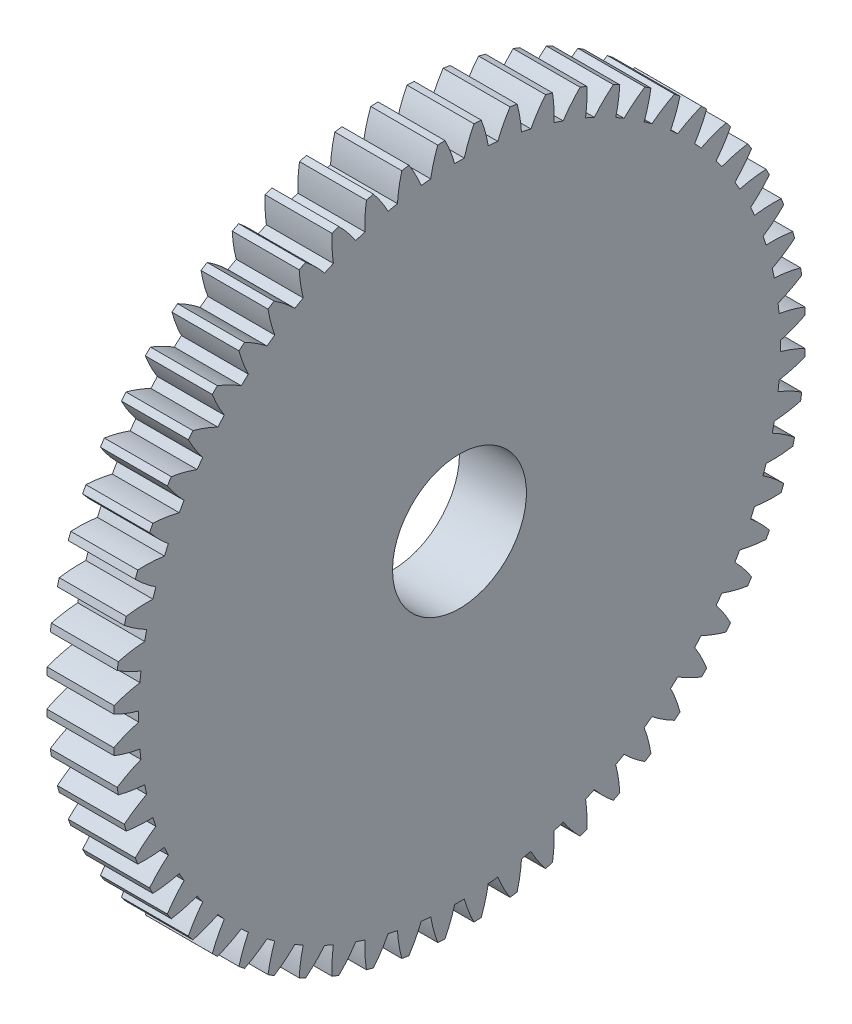
from build123d import *

# Parameters (mm, degrees)
BASPROSKE_W     = 3
BASPROSKE_H     = 15.5
TOOTHCUT_DEPTH  = 23.12464689
TEETHCUTS_COUNT = 60
TEETHCUTS_ANGLE = 354
BORSKE_R        = 3
BORE_DEPTH      = 50.0000508


with BuildPart() as part:
    # BasProSke → Base-Revolve (revolve)
    with BuildSketch(Plane(origin=(0, 0, 0), x_dir=(1, 0, 0), z_dir=(0, 1, 0)), mode=Mode.PRIVATE) as base_revolve_sk:
        with Locations((1.5, 7.75)):
            Rectangle(BASPROSKE_W, BASPROSKE_H)
    revolve(base_revolve_sk.sketch.rotate(Axis((-10, 0, 0), (1, 0, 0)), 180), axis=Axis((-10, 0, 0), (1, 0, 0)))

    # TooCutSke → ToothCut (cut, through all)
    with BuildSketch(Plane(origin=(0, 0, 0), x_dir=(0, 0, -1), z_dir=(1, 0, 0))):
        with BuildLine():
            ThreePointArc((0.21493681, 14.372392917), (0, 14.374), (-0.21493681, 14.372392917))
            ThreePointArc((-0.21493681, 14.372392917), (-0.409732631, 14.953266942), (-0.662749221, 15.51124781))
            ThreePointArc((-0.662749221, 15.51124781), (0, 15.5254), (0.662749221, 15.51124781))
            ThreePointArc((0.662749221, 15.51124781), (0.409732631, 14.953266942), (0.21493681, 14.372392917))
        make_face()
    toothcut = extrude(amount=TOOTHCUT_DEPTH, mode=Mode.SUBTRACT)

    # TeethCuts: ToothCut ×60 about axis
    teethcuts_axis = Axis((-10, 0, 0), (1, 0, 0))
    for i in range(1, TEETHCUTS_COUNT):
        add(toothcut.rotate(teethcuts_axis, i * TEETHCUTS_ANGLE / (TEETHCUTS_COUNT - 1)), mode=Mode.SUBTRACT)

    # BorSke → Bore (cut, symmetric)
    with BuildSketch(Plane(origin=(0, 0, 0), x_dir=(0, 0, -1), z_dir=(1, 0, 0))):
        with Locations(Location((0, 0, 0), (0, 0, 180))):
            Circle(BORSKE_R)
    extrude(amount=BORE_DEPTH, both=True, mode=Mode.SUBTRACT)


solid = part.part
